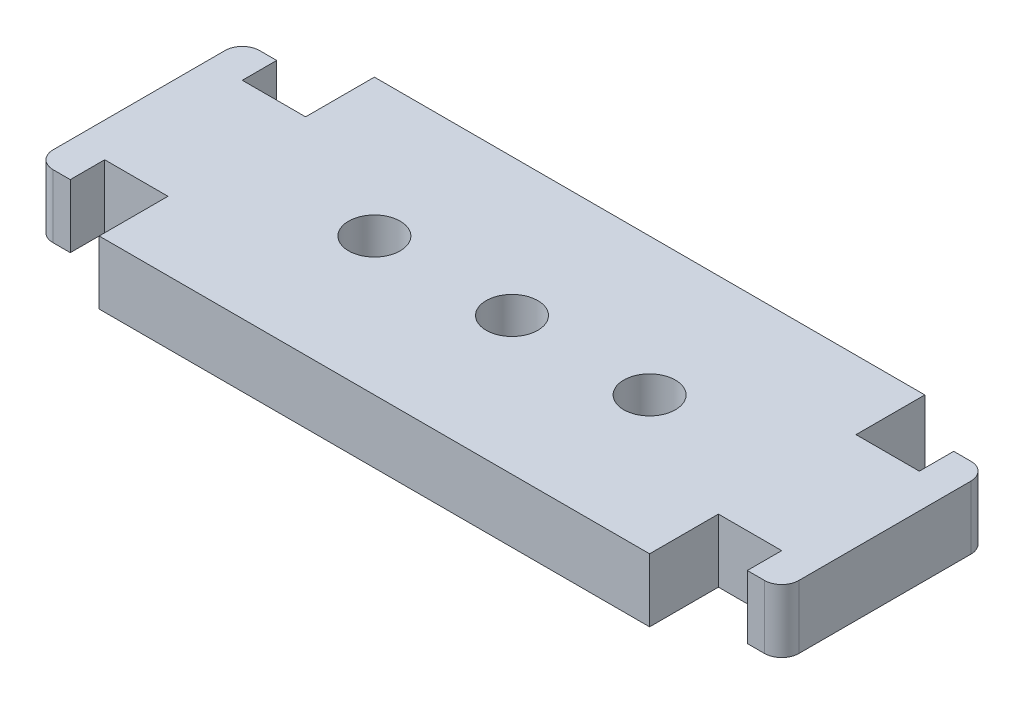
from build123d import *

# Parameters (mm, degrees)
BOSS_EXTRUDE1_DEPTH = 5.842
FILLET1_R           = 1.5875
SKETCH2_R           = 2.38125
CUT_EXTRUDE1_DEPTH  = 38.14766282


with BuildPart() as part:
    # Sketch1 → Boss-Extrude1 (new body)
    with BuildSketch(Plane(origin=(0, 0, 0), x_dir=(1, 0, 0), z_dir=(0, 1, 0))):
        Polygon((-25.4, -12.7), (25.4, -12.7), (25.4, -6.35), (31.242, -6.35), (31.242, -9.525), (34.417, -9.525), (34.417, 9.525), (31.242, 9.525), (31.242, 6.35), (25.4, 6.35), (25.4, 12.7), (-25.4, 12.7), (-25.4, 6.35), (-31.242, 6.35), (-31.242, 9.525), (-34.417, 9.525), (-34.417, -9.525), (-31.242, -9.525), (-31.242, -6.35), (-25.4, -6.35), align=None)
    extrude(amount=BOSS_EXTRUDE1_DEPTH)

    # Fillet1
    fillet1_edges = [part.edges().sort_by_distance(p)[0] for p in [
        (34.417, 2.921, -9.525),
        (34.417, 2.921, 9.525),
        (-34.417, 2.921, 9.525),
        (-34.417, 2.921, -9.525),
    ]]
    fillet(fillet1_edges, radius=FILLET1_R)

    # Sketch2 → Cut-Extrude1 (cut, through all)
    with BuildSketch(Plane(origin=(0, 5.842, 0), x_dir=(1, 0, 0), z_dir=(0, 1, 0))):
        with Locations(Location((0, 0, 0), (0, 0, 270))):
            Circle(SKETCH2_R)
        with Locations(Location((12.7, 0, 0), (0, 0, 270))):
            Circle(SKETCH2_R)
        with Locations(Location((-12.7, 0, 0), (0, 0, 90))):
            Circle(SKETCH2_R)
    extrude(amount=-CUT_EXTRUDE1_DEPTH, mode=Mode.SUBTRACT)


solid = part.part
